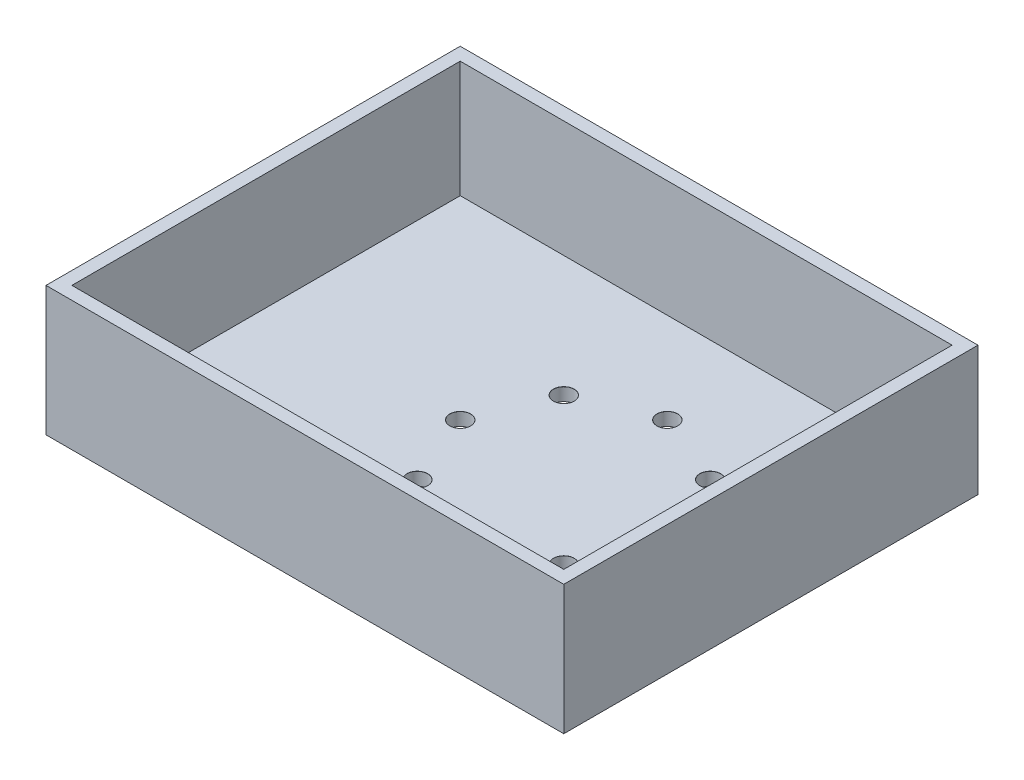
from build123d import *

# Parameters (mm, degrees)
SKETCH_2_W               = 200
SKETCH_2_H               = 50
EXTRUDE_1_DEPTH          = 160
SHELL_1_T                = -5
M8X1_0_1_D               = 8
M8X1_0_1_CSINK_D         = 8.05
M8X1_0_1_CSINK_ANGLE     = 100
PATTERN_CIRCULAR_1_COUNT = 8


with BuildPart() as part:
    # 草图2 → 凸台-拉伸1 (new body)
    with BuildSketch(Plane.XY):
        with Locations((-100, 25)):
            Rectangle(SKETCH_2_W, SKETCH_2_H)
    extrude(amount=EXTRUDE_1_DEPTH)

    # 抽壳1
    shell_1_openings = [part.faces().sort_by_distance(p)[0] for p in [
        (-100, 50, 80),
    ]]
    offset(amount=SHELL_1_T, openings=shell_1_openings, kind=Kind.INTERSECTION)

    # M8x1.0 螺纹孔1 (through all)
    with Locations(Plane(origin=(0, 5, 0), x_dir=(1, 0, 0), z_dir=(0, 1, 0))):
        with Locations((-80, -40)):
            m8x1_0_1 = CounterSinkHole(M8X1_0_1_D / 2, M8X1_0_1_CSINK_D / 2, counter_sink_angle=M8X1_0_1_CSINK_ANGLE)

    # 阵列(圆周)1: M8x1.0 螺纹孔1 ×8 about axis
    pattern_circular_1_axis = Axis((-80, 0, 80), (0, 1, 0))
    for i in range(1, PATTERN_CIRCULAR_1_COUNT):
        add(m8x1_0_1.rotate(pattern_circular_1_axis, i * 360 / PATTERN_CIRCULAR_1_COUNT), mode=Mode.SUBTRACT)


solid = part.part
